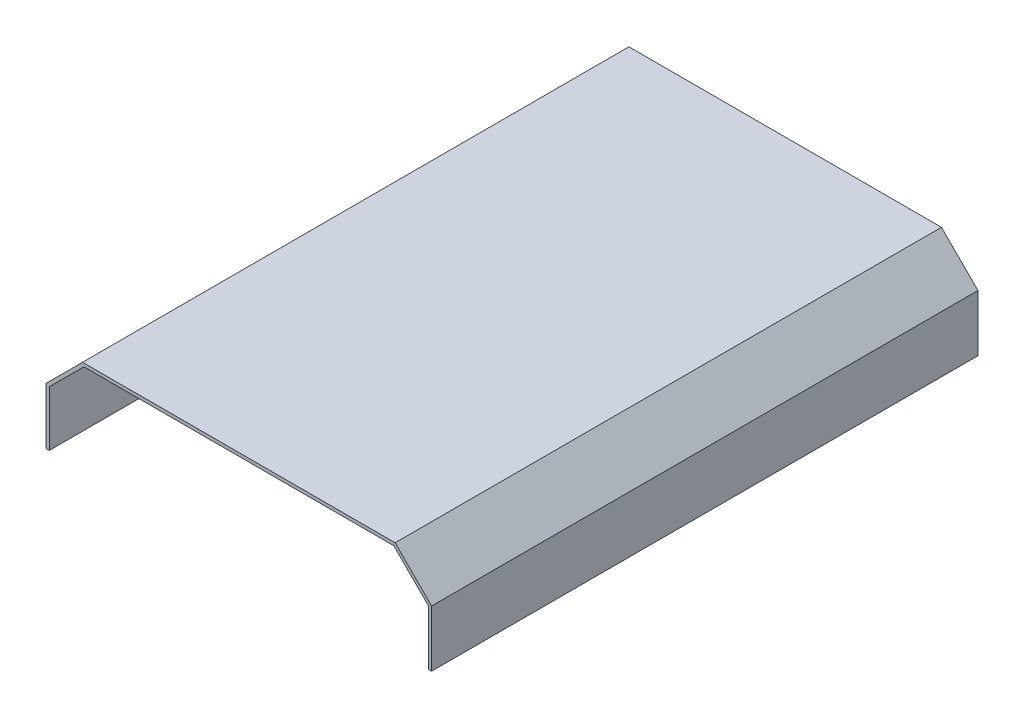
from build123d import *

# Parameters (mm, degrees)
BOSS_EXTRU_2_DEPTH = 335


with BuildPart() as part:
    # Esquisse1 → Boss.-Extru.2 (new body)
    with BuildSketch(Plane.XY):
        Polygon((0, 0), (0, 33.79), (21.213203436, 55.003203436), (211.213203436, 55.003203436), (232.426406871, 33.79), (232.426406871, 0), (234.426406871, 0), (234.426406871, 34.618427125), (212.04163056, 57.003203436), (20.384776311, 57.003203436), (-2, 34.618427125), (-2, 0), align=None)
    extrude(amount=BOSS_EXTRU_2_DEPTH)


solid = part.part
